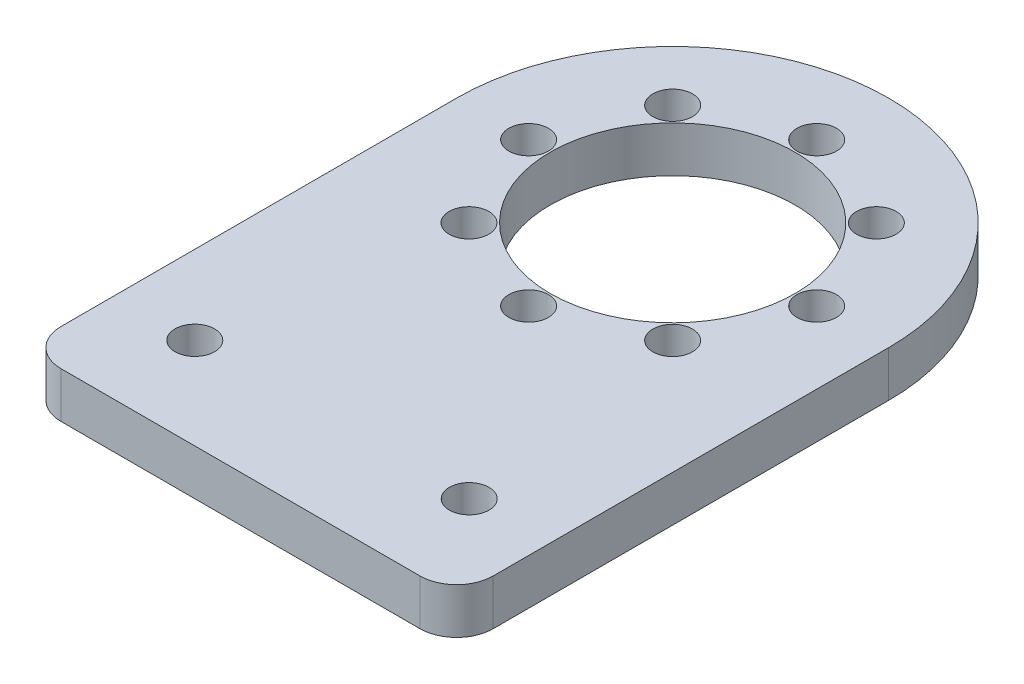
from build123d import *

# Parameters (mm, degrees)
BOSS_EXTRUDE1_DEPTH  = 6.35
SKETCH2_R            = 17
CUT_EXTRUDE1_DEPTH   = 109.352768769
M5_CLEARANCE_HOLE1_D = 5.5
M5_CLEARANCE_HOLE2_D = 5.5
FILLET1_R            = 5.08


with BuildPart() as part:
    # Sketch1 → Boss-Extrude1 (new body)
    with BuildSketch(Plane(origin=(0, 0, 0), x_dir=(1, 0, 0), z_dir=(0, 1, 0))):
        with BuildLine():
            Line((0, 60), (0, 0))
            Line((0, 0), (60, 0))
            Line((60, 0), (60, 60))
            ThreePointArc((60, 60), (30, 90), (0, 60))
        make_face()
    extrude(amount=BOSS_EXTRUDE1_DEPTH)

    # Sketch2 → Cut-Extrude1 (cut, through all)
    with BuildSketch(Plane(origin=(0, 6.35, 0), x_dir=(1, 0, 0), z_dir=(0, 1, 0))):
        with Locations(Location((30, 60, 0), (0, 0, 270))):
            Circle(SKETCH2_R)
    extrude(amount=-CUT_EXTRUDE1_DEPTH, mode=Mode.SUBTRACT)

    # M5 Clearance Hole1 (through all)
    with Locations(Plane(origin=(0, 6.35, 0), x_dir=(-1, 0, 0), z_dir=(0, 1, 0))):
        with Locations((-15.857864376, -74.142135624), (-44.142135624, -45.857864376), (-44.142135624, -74.142135624), (-15.857864376, -45.857864376), (-30, -80), (-50, -60), (-30, -40), (-10, -60)):
            Hole(M5_CLEARANCE_HOLE1_D / 2)

    # M5 Clearance Hole2 (through all)
    with Locations(Plane(origin=(0, 6.35, 0), x_dir=(-1, 0, 0), z_dir=(0, 1, 0))):
        with Locations((-10.95, -12.7), (-49.05, -12.7)):
            Hole(M5_CLEARANCE_HOLE2_D / 2)

    # Fillet1
    fillet1_edges = [part.edges().sort_by_distance(p)[0] for p in [
        (60, 3.175, 0),
        (0, 3.175, 0),
    ]]
    fillet(fillet1_edges, radius=FILLET1_R)


solid = part.part
